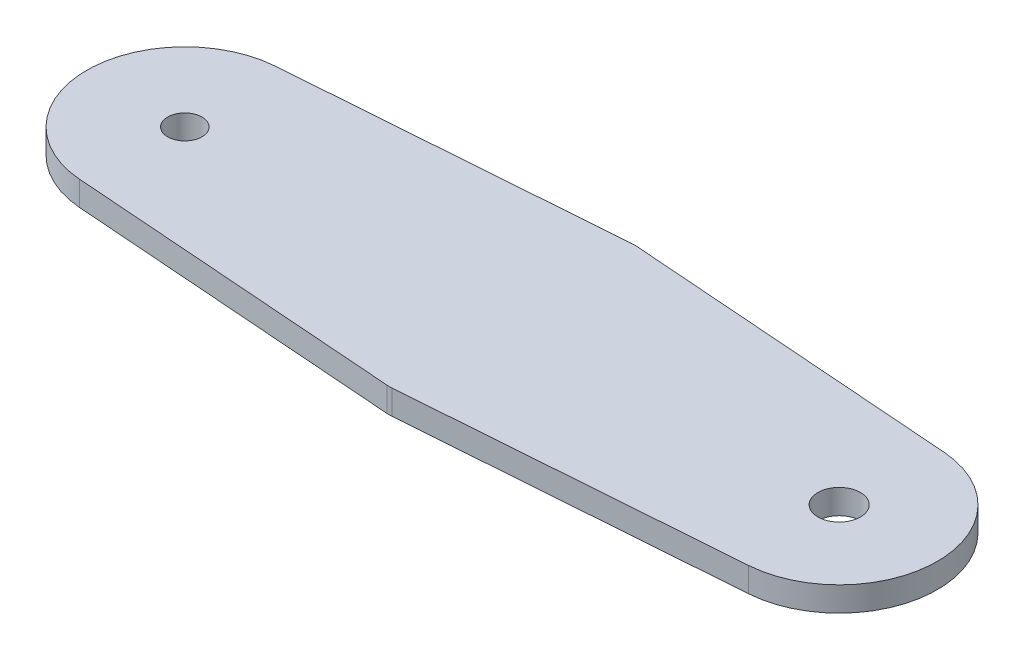
from build123d import *

# Parameters (mm, degrees)
SKETCH_1_R      = 2.1
SKETCH_1_R_2    = 2.6
EXTRUDE_1_DEPTH = 3
FILLET_1_R      = 4


with BuildPart() as part:
    # 草图1 → 凸台-拉伸1 (new body)
    with BuildSketch(Plane(origin=(0, 0, 0), x_dir=(1, 0, 0), z_dir=(0, 1, 0))):
        with BuildLine():
            Line((40, 15), (80.887671233, 11.967123288))
            ThreePointArc((80.887671233, 11.967123288), (92, 0), (80.887671233, -11.967123288))
            Line((80.887671233, -11.967123288), (40, -15))
            Line((40, -15), (-0.887671233, -11.967123288))
            ThreePointArc((-0.887671233, -11.967123288), (-12, 0), (-0.887671233, 11.967123288))
            Line((-0.887671233, 11.967123288), (40, 15))
        make_face()
        with Locations(Location((0, 0, 0), (0, 0, 270))):
            Circle(SKETCH_1_R, mode=Mode.SUBTRACT)
        with Locations(Location((80, 0, 0), (0, 0, 270))):
            Circle(SKETCH_1_R_2, mode=Mode.SUBTRACT)
    extrude(amount=EXTRUDE_1_DEPTH)

    # 圆角1
    fillet_1_edges = [part.edges().sort_by_distance(p)[0] for p in [
        (40, 1.5, -15),
        (40, 1.5, 15),
    ]]
    fillet(fillet_1_edges, radius=FILLET_1_R)


solid = part.part
